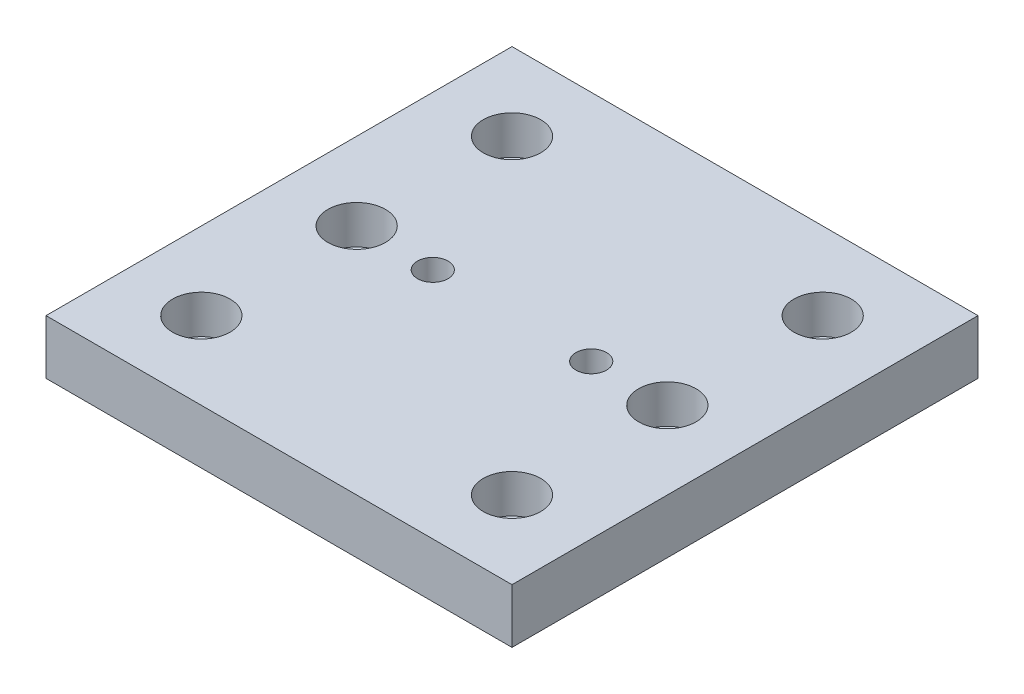
from build123d import *

# Parameters (mm, degrees)
SKETCH1_W                       = 76.2
SKETCH1_H                       = 76.2
BOSS_EXTRUDE1_DEPTH             = 8.89
TAP_DRILL_FOR_M6X1_0_TAP1_D     = 5
TAP_DRILL_FOR_M6X1_0_TAP1_DEPTH = 8.89
TAP_DRILL_FOR_M6X1_0_TAP1_TIP   = 1.502151548
CBORE_FOR_M6_SHCS1_D            = 6.6
CBORE_FOR_M6_SHCS1_DEPTH        = 8.89
CBORE_FOR_M6_SHCS1_CBORE_D      = 9.4
CBORE_FOR_M6_SHCS1_CBORE_DEPTH  = 6.3
CBORE_FOR_M6_SHCS1_TIP          = 1.982840043


with BuildPart() as part:
    # Sketch1 → Boss-Extrude1 (new body)
    with BuildSketch(Plane(origin=(0, 0, 0), x_dir=(1, 0, 0), z_dir=(0, 1, 0))):
        Rectangle(SKETCH1_W, SKETCH1_H)
    extrude(amount=BOSS_EXTRUDE1_DEPTH)

    # Tap Drill for M6x1.0 Tap1
    with Locations(Plane(origin=(0, 8.89, 0), x_dir=(1, 0, 0), z_dir=(0, 1, 0))):
        with Locations((-12.954, 0), (12.954, 0)):
            Hole(TAP_DRILL_FOR_M6X1_0_TAP1_D / 2, depth=TAP_DRILL_FOR_M6X1_0_TAP1_DEPTH)
            with Locations((0, 0, -(TAP_DRILL_FOR_M6X1_0_TAP1_DEPTH + TAP_DRILL_FOR_M6X1_0_TAP1_TIP / 2))):  # 118° drill point
                Cone(0, TAP_DRILL_FOR_M6X1_0_TAP1_D / 2, TAP_DRILL_FOR_M6X1_0_TAP1_TIP, mode=Mode.SUBTRACT)

    # CBORE for M6 SHCS1
    with Locations(Plane(origin=(0, 8.89, 0), x_dir=(1, 0, 0), z_dir=(0, 1, 0))):
        with Locations((-25.4, 25.4), (25.4, 25.4), (25.4, -25.4), (-25.4, -25.4), (-25.4, 0), (25.4, 0)):
            CounterBoreHole(CBORE_FOR_M6_SHCS1_D / 2, CBORE_FOR_M6_SHCS1_CBORE_D / 2, CBORE_FOR_M6_SHCS1_CBORE_DEPTH, depth=CBORE_FOR_M6_SHCS1_DEPTH)
            with Locations((0, 0, -(CBORE_FOR_M6_SHCS1_DEPTH + CBORE_FOR_M6_SHCS1_TIP / 2))):  # 118° drill point
                Cone(0, CBORE_FOR_M6_SHCS1_D / 2, CBORE_FOR_M6_SHCS1_TIP, mode=Mode.SUBTRACT)


solid = part.part
